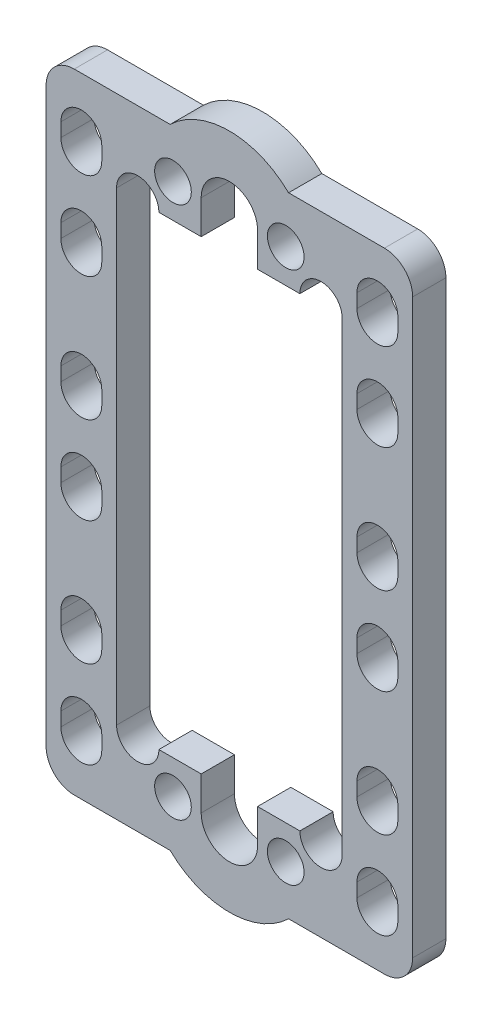
from build123d import *

# Parameters (mm, degrees)
SKETCH1_W           = 20.32
SKETCH1_H           = 41.91
BOSS_EXTRUDE1_DEPTH = 2.9972
SKETCH2_R           = 1.651
CUT_EXTRUDE1_DEPTH  = 35.793587165
CUT_EXTRUDE2_DEPTH  = 35.793587165
FILLET1_R           = 2.54


with BuildPart() as part:
    # Sketch1 → Boss-Extrude1 (new body)
    with BuildSketch(Plane.XY):
        with BuildLine():
            Line((16.51, 28.321), (5.334, 28.321))
            ThreePointArc((5.334, 28.321), (0, 30.48), (-5.334, 28.321))
            Line((-5.334, 28.321), (-16.51, 28.321))
            Line((-16.51, 28.321), (-16.51, -28.321))
            Line((-16.51, -28.321), (-5.334, -28.321))
            ThreePointArc((-5.334, -28.321), (0, -30.48), (5.334, -28.321))
            Line((5.334, -28.321), (16.51, -28.321))
            Line((16.51, -28.321), (16.51, 28.321))
        make_face()
        Rectangle(SKETCH1_W, SKETCH1_H, mode=Mode.SUBTRACT)
    extrude(amount=BOSS_EXTRUDE1_DEPTH)

    # Sketch2 → Cut-Extrude1 (cut, through all)
    with BuildSketch(Plane.XY.offset(2.9972)):
        with Locations((-5.08, 24)):
            Circle(SKETCH2_R)
        with Locations((5.08, 24)):
            Circle(SKETCH2_R)
        with Locations((5.08, -24)):
            Circle(SKETCH2_R)
        with Locations((-5.08, -24)):
            Circle(SKETCH2_R)
        with BuildLine():
            Line((-6.35, 20.955), (-6.35, -20.955))
            ThreePointArc((-6.35, -20.955), (-8.255, -22.86), (-10.16, -20.955))
            Line((-10.16, -20.955), (-10.16, 20.955))
            ThreePointArc((-10.16, 20.955), (-8.255, 22.86), (-6.35, 20.955))
        make_face()
        with BuildLine():
            Line((6.35, 20.955), (6.35, -20.955))
            ThreePointArc((6.35, -20.955), (8.255, -22.86), (10.16, -20.955))
            Line((10.16, -20.955), (10.16, 20.955))
            ThreePointArc((10.16, 20.955), (8.255, 22.86), (6.35, 20.955))
        make_face()
        with BuildLine():
            Line((-2.54, -24), (-2.54, 24))
            ThreePointArc((-2.54, 24), (0, 26.54), (2.54, 24))
            Line((2.54, 24), (2.54, -24))
            ThreePointArc((2.54, -24), (0, -26.54), (-2.54, -24))
        make_face()
    extrude(amount=-CUT_EXTRUDE1_DEPTH, mode=Mode.SUBTRACT)

    # Sketch3 → Cut-Extrude2 (cut, through all)
    with BuildSketch(Plane.XY.offset(2.9972)):
        with BuildLine():
            Line((-11.4935, 23.604394695), (-11.4935, 22.369605305))
            ThreePointArc((-11.4935, 22.369605305), (-13.335, 20.528105305), (-15.1765, 22.369605305))
            Line((-15.1765, 22.369605305), (-15.1765, 23.604394695))
            ThreePointArc((-15.1765, 23.604394695), (-13.335, 25.445894695), (-11.4935, 23.604394695))
        make_face()
        with BuildLine():
            Line((-11.4935, 15.730394695), (-11.4935, 14.495605305))
            ThreePointArc((-11.4935, 14.495605305), (-13.335, 12.654105305), (-15.1765, 14.495605305))
            Line((-15.1765, 14.495605305), (-15.1765, 15.730394695))
            ThreePointArc((-15.1765, 15.730394695), (-13.335, 17.571894695), (-11.4935, 15.730394695))
        make_face()
        with BuildLine():
            Line((-11.4935, 4.554394695), (-11.4935, 3.319605305))
            ThreePointArc((-11.4935, 3.319605305), (-13.335, 1.478105305), (-15.1765, 3.319605305))
            Line((-15.1765, 3.319605305), (-15.1765, 4.554394695))
            ThreePointArc((-15.1765, 4.554394695), (-13.335, 6.395894695), (-11.4935, 4.554394695))
        make_face()
        with BuildLine():
            Line((-11.4935, -3.319605305), (-11.4935, -4.554394695))
            ThreePointArc((-11.4935, -4.554394695), (-13.335, -6.395894695), (-15.1765, -4.554394695))
            Line((-15.1765, -4.554394695), (-15.1765, -3.319605305))
            ThreePointArc((-15.1765, -3.319605305), (-13.335, -1.478105305), (-11.4935, -3.319605305))
        make_face()
        with BuildLine():
            Line((-11.4935, -14.495605305), (-11.4935, -15.730394695))
            ThreePointArc((-11.4935, -15.730394695), (-13.335, -17.571894695), (-15.1765, -15.730394695))
            Line((-15.1765, -15.730394695), (-15.1765, -14.495605305))
            ThreePointArc((-15.1765, -14.495605305), (-13.335, -12.654105305), (-11.4935, -14.495605305))
        make_face()
        with BuildLine():
            Line((-11.4935, -22.369605305), (-11.4935, -23.604394695))
            ThreePointArc((-11.4935, -23.604394695), (-13.335, -25.445894695), (-15.1765, -23.604394695))
            Line((-15.1765, -23.604394695), (-15.1765, -22.369605305))
            ThreePointArc((-15.1765, -22.369605305), (-13.335, -20.528105305), (-11.4935, -22.369605305))
        make_face()
    cut_extrude2 = extrude(amount=-CUT_EXTRUDE2_DEPTH, mode=Mode.SUBTRACT)

    # Mirror1: Cut-Extrude2 across plane
    add(cut_extrude2.mirror(Plane(origin=(0, 0, 0), x_dir=(0, 0, 1), z_dir=(1, 0, 0))), mode=Mode.SUBTRACT)

    # Fillet1
    fillet1_edges = [part.edges().sort_by_distance(p)[0] for p in [
        (-16.51, -28.321, 1.4986),
        (-16.51, 28.321, 1.4986),
        (16.51, 28.321, 1.4986),
        (16.51, -28.321, 1.4986),
    ]]
    fillet(fillet1_edges, radius=FILLET1_R)


solid = part.part
